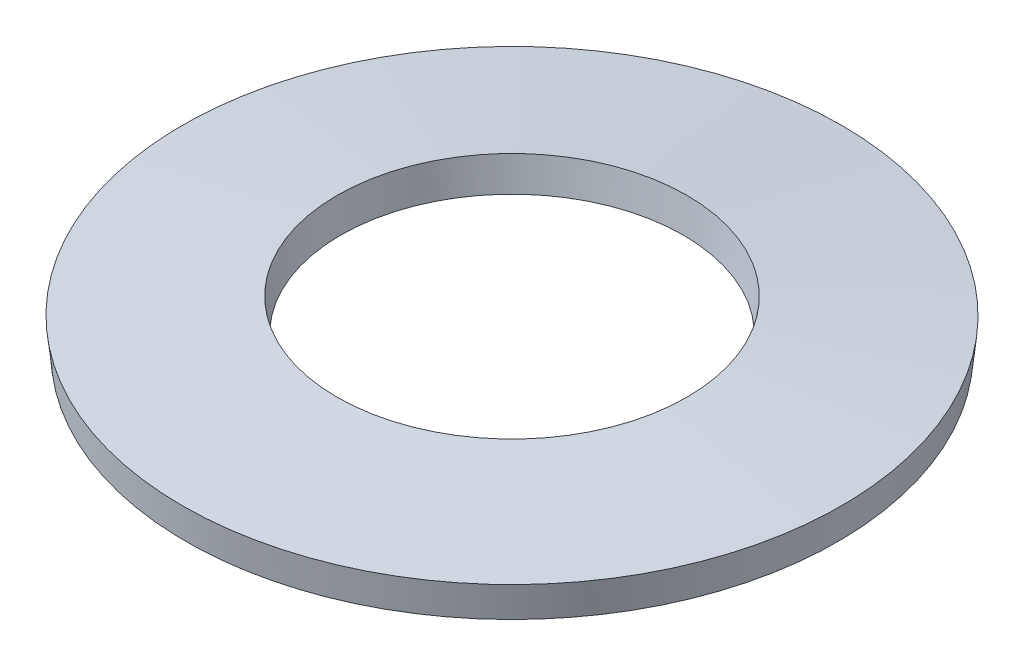
from build123d import *


with BuildPart() as part:
    # Sketch1 → Revolve1 (revolve)
    with BuildSketch(Plane.XY, mode=Mode.PRIVATE) as revolve1_sk:
        Polygon((4.946424278, 0), (2.6, 0.252878645), (2.653575722, 0.75), (5, 0.497121355), align=None)
    revolve(revolve1_sk.sketch.rotate(Axis((0, 0, 0), (0, 1, 0)), 90), axis=Axis((0, 0, 0), (0, 1, 0)))


solid = part.part
